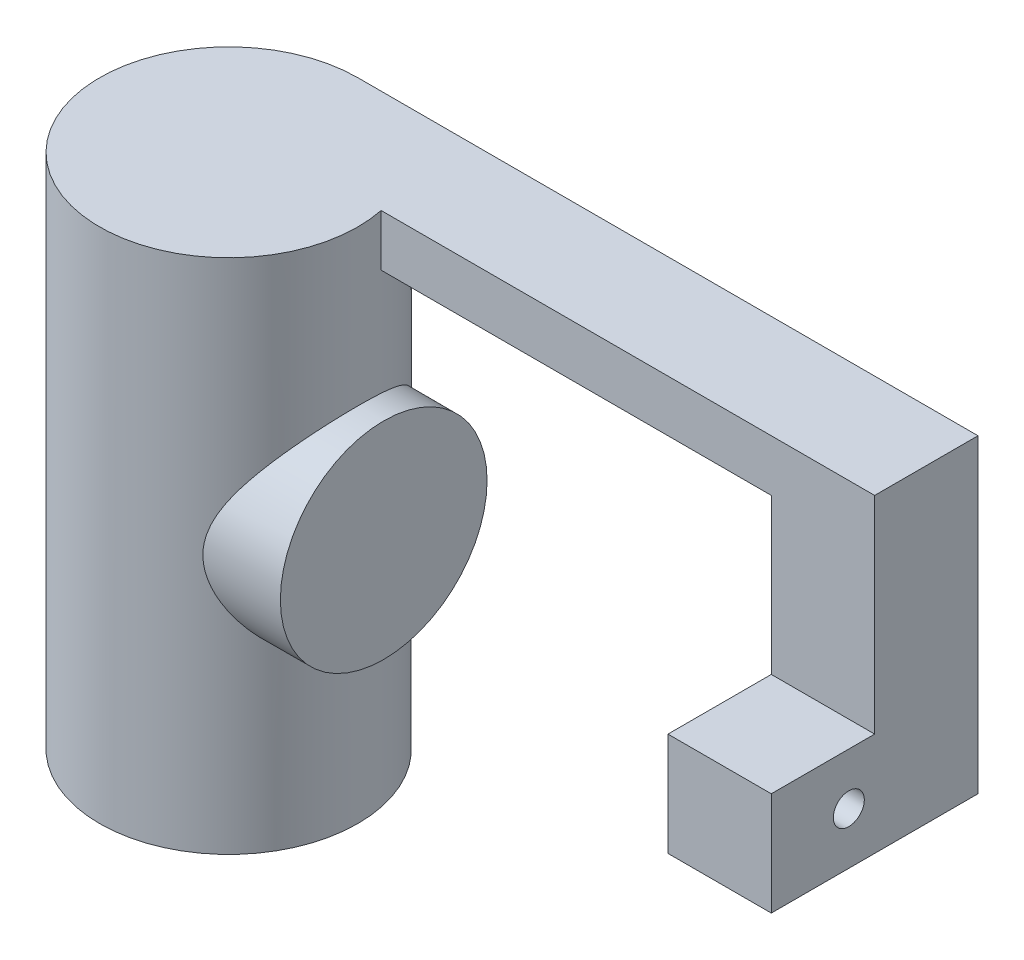
from build123d import *

# Parameters (mm, degrees)
SKETCH1_R           = 25
BOSS_EXTRUDE1_DEPTH = 50
SKETCH2_R           = 20
BOSS_EXTRUDE2_DEPTH = 30
SKETCH3_W           = 20
SKETCH3_H           = 10
BOSS_EXTRUDE3_DEPTH = 120
SKETCH4_W           = 20
SKETCH4_H           = 20
BOSS_EXTRUDE4_DEPTH = 50
SKETCH5_W           = 20
SKETCH5_H           = 20
BOSS_EXTRUDE5_DEPTH = 40
SKETCH6_R           = 3
CUT_EXTRUDE1_DEPTH  = 20


with BuildPart() as part:
    # Sketch1 → Boss-Extrude1 (new, symmetric)
    with BuildSketch(Plane(origin=(0, 0, 0), x_dir=(1, 0, 0), z_dir=(0, 1, 0))):
        with Locations(Location((0, 0, 0), (0, 0, 270))):
            Circle(SKETCH1_R)
    extrude(amount=BOSS_EXTRUDE1_DEPTH, both=True)

    # Sketch2 → Boss-Extrude2 (add)
    with BuildSketch(Plane(origin=(0, 0, 0), x_dir=(0, 0, -1), z_dir=(1, 0, 0))):
        with Locations(Location((0, 0, 0), (0, 0, 180))):
            Circle(SKETCH2_R)
    extrude(amount=BOSS_EXTRUDE2_DEPTH)

    # Sketch3 → Boss-Extrude3 (add)
    with BuildSketch(Plane(origin=(0, 0, 0), x_dir=(0, 0, -1), z_dir=(1, 0, 0))):
        with Locations((15, 45)):
            Rectangle(SKETCH3_W, SKETCH3_H)
    extrude(amount=BOSS_EXTRUDE3_DEPTH)

    # Sketch4 → Boss-Extrude4 (add)
    with BuildSketch(Plane.XZ.offset(-40)):
        with Locations((110, -15)):
            Rectangle(SKETCH4_W, SKETCH4_H)
    extrude(amount=BOSS_EXTRUDE4_DEPTH)

    # Sketch5 → Boss-Extrude5 (add)
    with BuildSketch(Plane(origin=(0, 0, -25), x_dir=(-1, 0, 0), z_dir=(0, 0, -1))):
        with Locations((-110, 0)):
            Rectangle(SKETCH5_W, SKETCH5_H)
    extrude(amount=-BOSS_EXTRUDE5_DEPTH)

    # Sketch6 → Cut-Extrude1 (cut)
    with BuildSketch(Plane(origin=(120, 0, 0), x_dir=(0, 0, -1), z_dir=(1, 0, 0))):
        Circle(SKETCH6_R)
    extrude(amount=-CUT_EXTRUDE1_DEPTH, mode=Mode.SUBTRACT)


solid = part.part
